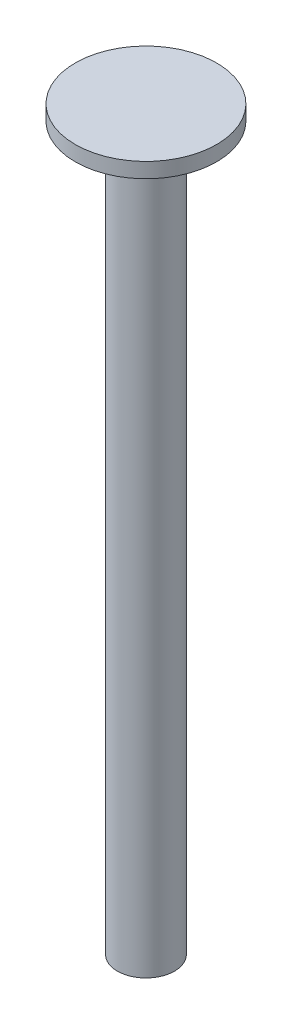
from build123d import *

# Parameters (mm, degrees)
SKETCH_1_R      = 0.95
EXTRUDE_1_DEPTH = 24
SKETCH_3_R      = 2.35
EXTRUDE_2_DEPTH = 0.5


with BuildPart() as part:
    # Эскиз1 → Бобышка-Вытянуть1 (new body)
    with BuildSketch(Plane(origin=(0, 0, 0), x_dir=(1, 0, 0), z_dir=(0, 1, 0))):
        with Locations(Location((0, 0, 0), (0, 0, 270))):
            Circle(SKETCH_1_R)
    extrude(amount=EXTRUDE_1_DEPTH)

    # Эскиз3 → Бобышка-Вытянуть2 (add)
    with BuildSketch(Plane(origin=(0, 24, 0), x_dir=(1, 0, 0), z_dir=(0, 1, 0))):
        with Locations(Location((0, 0, 0), (0, 0, 270))):
            Circle(SKETCH_3_R)
    extrude(amount=EXTRUDE_2_DEPTH)


solid = part.part
